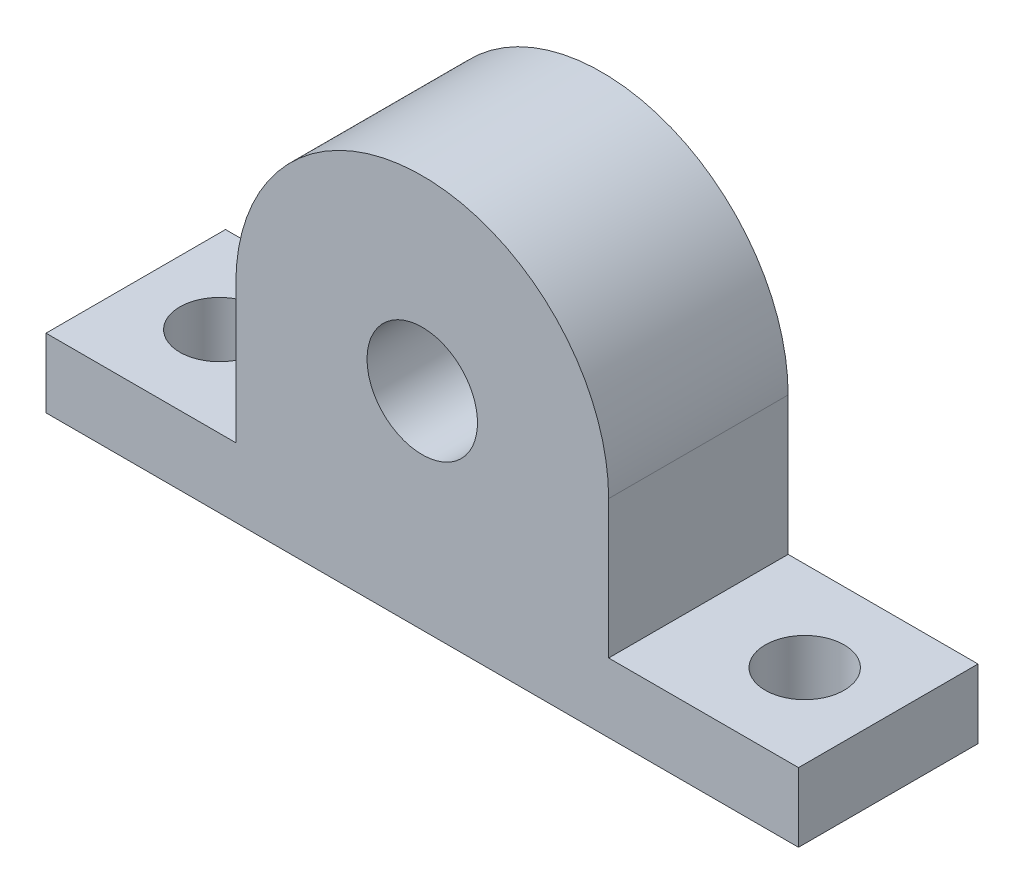
from build123d import *

# Parameters (mm, degrees)
SKETCH1_R           = 4
BOSS_EXTRUDE1_DEPTH = 13
SKETCH2_R           = 2.853745902
CUT_EXTRUDE1_DEPTH  = 13


with BuildPart() as part:
    # Sketch1 → Boss-Extrude1 (new body)
    with BuildSketch(Plane.XY):
        with BuildLine():
            Line((0, 0), (54.5, 0))
            Line((54.5, 0), (54.5, 5))
            Line((54.5, 5), (40.75, 5))
            Line((40.75, 5), (40.75, 15))
            ThreePointArc((40.75, 15), (27.25, 28.5), (13.75, 15))
            Line((13.75, 15), (13.75, 5))
            Line((13.75, 5), (0, 5))
            Line((0, 5), (0, 0))
        make_face()
        with Locations(Location((27.25, 15, 0), (0, 0, 180))):
            Circle(SKETCH1_R, mode=Mode.SUBTRACT)
    extrude(amount=BOSS_EXTRUDE1_DEPTH)

    # Sketch2 → Cut-Extrude1 (cut)
    with BuildSketch(Plane(origin=(0, 5, 0), x_dir=(1, 0, 0), z_dir=(0, 1, 0))):
        with Locations(Location((48.45, -6.5, 0), (0, 0, 180))):
            Circle(SKETCH2_R)
        with Locations(Location((6.05, -6.5, 0), (0, 0, 180))):
            Circle(SKETCH2_R)
    extrude(amount=-CUT_EXTRUDE1_DEPTH, mode=Mode.SUBTRACT)


solid = part.part
